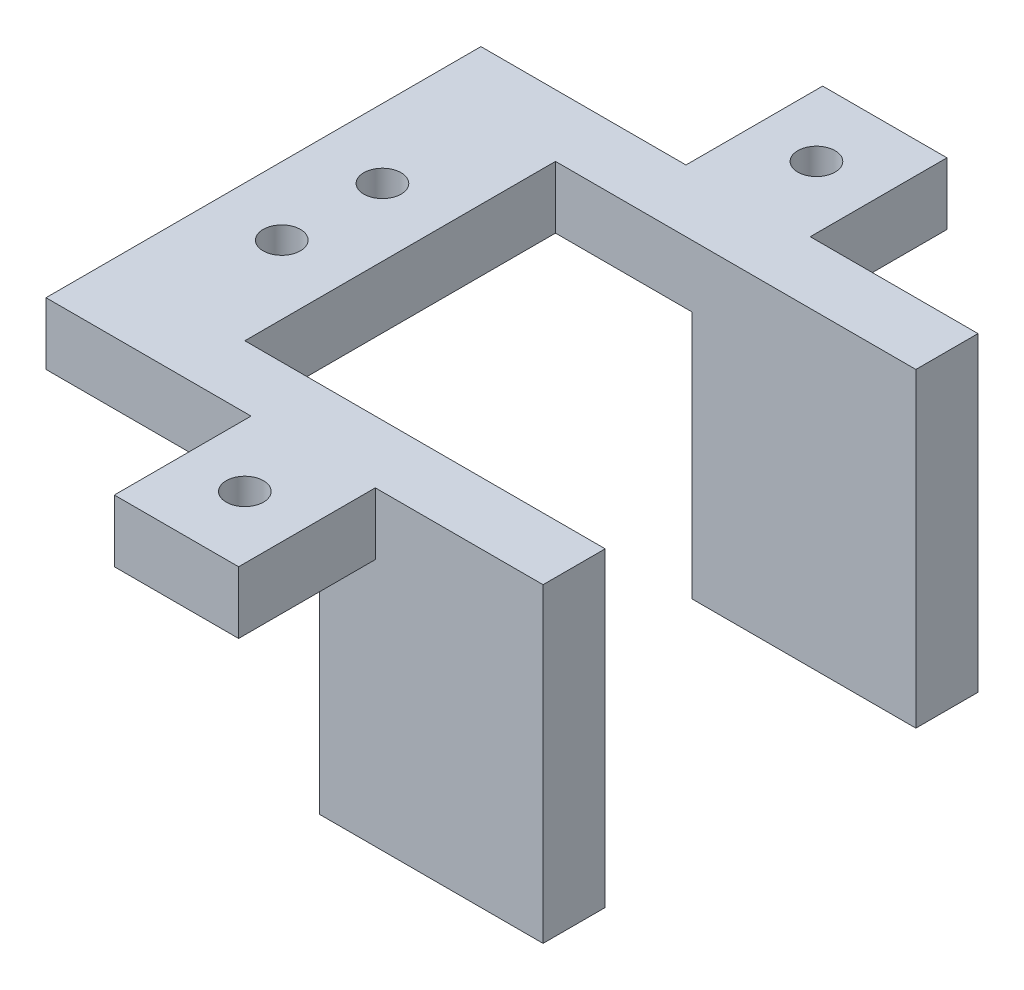
from build123d import *

# Parameters (mm, degrees)
BOSS_EXTRUDE1_DEPTH              = 5
SKETCH3_W                        = 11
SKETCH3_H                        = 5
BOSS_EXTRUDE2_DEPTH              = 5
SKETCH4_W                        = 5
SKETCH4_H                        = 5
BOSS_EXTRUDE3_DEPTH              = 21
SKETCH5_W                        = 10
SKETCH5_H                        = 5
BOSS_EXTRUDE4_DEPTH              = 20
SKETCH6_W                        = 11
SKETCH6_H                        = 5
BOSS_EXTRUDE5_DEPTH              = 5
SKETCH7_W                        = 5
SKETCH7_H                        = 5
BOSS_EXTRUDE6_DEPTH              = 21
SKETCH8_W                        = 10
SKETCH8_H                        = 5
BOSS_EXTRUDE7_DEPTH              = 20
SKETCH11_W                       = 10
SKETCH11_H                       = 5
BOSS_EXTRUDE8_DEPTH              = 3.5
SKETCH12_W                       = 10
SKETCH12_H                       = 5
BOSS_EXTRUDE9_DEPTH              = 3.5
CUT_EXTRUDE6_DEPTH               = 14.5
CUT_EXTRUDE8_DEPTH               = 41.078048855
CUT_EXTRUDE8_DEPTH_BACK          = 14.5
SKETCH17_W                       = 1.38
SKETCH17_H                       = 3.56
CUT_EXTRUDE9_DEPTH               = 14.5
CUT_EXTRUDE10_DEPTH              = 14.5
SKETCH_1_W                       = 8
SKETCH_1_H                       = 25
EXTRUDE_1_DEPTH                  = 5
SKETCH_2_W                       = 8
SKETCH_2_H                       = 25
EXTRUDE_2_DEPTH                  = 5
SKIZZE1_R                        = 1.5
SCHNITT_LINEAR_AUSTRAGEN1_DEPTH  = 10
AUFSATZ_LINEAR_AUSTRAGEN1_DEPTH  = 4
SKIZZE3_W                        = 10
SKIZZE3_H                        = 5
SCHNITT_LINEAR_AUSTRAGEN2_DEPTH  = 3.5
SCHNITT_LINEAR_AUSTRAGEN3_DEPTH  = 4
AUFSATZ_LINEAR_AUSTRAGEN3_DEPTH  = 11
SKIZZE7_R                        = 1.5
SCHNITT_LINEAR_AUSTRAGEN6_DEPTH  = 10
SKIZZE8_W                        = 10
SKIZZE8_H                        = 5
SCHNITT_LINEAR_AUSTRAGEN8_DEPTH  = 4
AUFSATZ_LINEAR_AUSTRAGEN4_DEPTH  = 4
SCHNITT_LINEAR_AUSTRAGEN9_DEPTH  = 4
AUFSATZ_LINEAR_AUSTRAGEN6_DEPTH  = 11
SKIZZE12_R                       = 1.5
SCHNITT_LINEAR_AUSTRAGEN10_DEPTH = 11


with BuildPart() as part:
    # Sketch1 → Boss-Extrude1 (new body)
    with BuildSketch(Plane(origin=(0, 0, 0), x_dir=(1, 0, 0), z_dir=(0, 1, 0))):
        Polygon((5.5, 3), (5.5, 0), (5.5, -3), (5.5, -8.5), (0, -8.5), (-5.5, -8.5), (-5.5, -3), (-5.5, 8.5), (0, 8.5), (5.5, 8.5), align=None)
    extrude(amount=BOSS_EXTRUDE1_DEPTH)

    # Sketch3 → Boss-Extrude2 (add)
    with BuildSketch(Plane.XY.offset(8.5)):
        with Locations((0, 2.5)):
            Rectangle(SKETCH3_W, SKETCH3_H)
    extrude(amount=BOSS_EXTRUDE2_DEPTH)

    # Sketch4 → Boss-Extrude3 (add)
    with BuildSketch(Plane(origin=(5.5, 0, 0), x_dir=(0, 0, -1), z_dir=(1, 0, 0))):
        with Locations((-11, 2.5)):
            Rectangle(SKETCH4_W, SKETCH4_H)
    extrude(amount=BOSS_EXTRUDE3_DEPTH)

    # Sketch5 → Boss-Extrude4 (add)
    with BuildSketch(Plane.XZ):
        with Locations((21.5, 11)):
            Rectangle(SKETCH5_W, SKETCH5_H)
    extrude(amount=BOSS_EXTRUDE4_DEPTH)

    # Sketch6 → Boss-Extrude5 (add)
    with BuildSketch(Plane(origin=(0, 0, -8.5), x_dir=(-1, 0, 0), z_dir=(0, 0, -1))):
        with Locations((0, 2.5)):
            Rectangle(SKETCH6_W, SKETCH6_H)
    extrude(amount=BOSS_EXTRUDE5_DEPTH)

    # Sketch7 → Boss-Extrude6 (add)
    with BuildSketch(Plane(origin=(5.5, 0, 0), x_dir=(0, 0, -1), z_dir=(1, 0, 0))):
        with Locations((11, 2.5)):
            Rectangle(SKETCH7_W, SKETCH7_H)
    extrude(amount=BOSS_EXTRUDE6_DEPTH)

    # Sketch8 → Boss-Extrude7 (add)
    with BuildSketch(Plane(origin=(0, 0, 0), x_dir=(-1, 0, 0), z_dir=(0, -1, 0))):
        with Locations((-21.5, 11)):
            Rectangle(SKETCH8_W, SKETCH8_H)
    extrude(amount=BOSS_EXTRUDE7_DEPTH)

    # Sketch11 → Boss-Extrude8 (add)
    with BuildSketch(Plane(origin=(0, 0, 8.5), x_dir=(-1, 0, 0), z_dir=(0, 0, -1))):
        with Locations((-21.5, -12.5)):
            Rectangle(SKETCH11_W, SKETCH11_H)
    extrude(amount=BOSS_EXTRUDE8_DEPTH)

    # Sketch12 → Boss-Extrude9 (add)
    with BuildSketch(Plane.XY.offset(-8.5)):
        with Locations((21.5, -12.5)):
            Rectangle(SKETCH12_W, SKETCH12_H)
    extrude(amount=BOSS_EXTRUDE9_DEPTH)

    # Sketch14 → Cut-Extrude6 (cut)
    with BuildSketch(Plane(origin=(26.5, 0, 0), x_dir=(0, 0, -1), z_dir=(1, 0, 0))):
        Polygon((-6.379568334, -12.879568334), (-6.379568334, -15), (-5, -15), (-5, -11.439784167), (-6.379568334, -11.439784167), align=None)
    extrude(amount=-CUT_EXTRUDE6_DEPTH, mode=Mode.SUBTRACT)

    # Sketch16 → Cut-Extrude8 (cut, two sides: drawn at the far end of the back side and taken through both)
    with BuildSketch(Plane(origin=(26.5, 0, 0), x_dir=(0, 0, -1), z_dir=(1, 0, 0)).offset(-CUT_EXTRUDE8_DEPTH_BACK)):
        Polygon((-6.379568334, -13), (-8.5, -15), (-7.439784167, -15), (-6.379568334, -15), align=None)
    extrude(amount=CUT_EXTRUDE8_DEPTH + CUT_EXTRUDE8_DEPTH_BACK, mode=Mode.SUBTRACT)

    # Sketch17 → Cut-Extrude9 (cut)
    with BuildSketch(Plane(origin=(26.5, 0, 0), x_dir=(0, 0, -1), z_dir=(1, 0, 0))):
        with Locations((5.69, -13.22)):
            Rectangle(SKETCH17_W, SKETCH17_H)
    extrude(amount=-CUT_EXTRUDE9_DEPTH, mode=Mode.SUBTRACT)

    # Sketch18 → Cut-Extrude10 (cut)
    with BuildSketch(Plane(origin=(26.5, 0, 0), x_dir=(0, 0, -1), z_dir=(1, 0, 0))):
        Polygon((6.38, -13), (6.38, -15), (8.5, -15), align=None)
    extrude(amount=-CUT_EXTRUDE10_DEPTH, mode=Mode.SUBTRACT)

    # 草图1 → 凸台-拉伸1 (add)
    with BuildSketch(Plane.XY.offset(13.5)):
        with Locations((30.5, -7.5)):
            Rectangle(SKETCH_1_W, SKETCH_1_H)
    extrude(amount=-EXTRUDE_1_DEPTH)

    # 草图2 → 凸台-拉伸2 (add)
    with BuildSketch(Plane(origin=(0, 0, -13.5), x_dir=(-1, 0, 0), z_dir=(0, 0, -1))):
        with Locations((-30.5, -7.5)):
            Rectangle(SKETCH_2_W, SKETCH_2_H)
    extrude(amount=-EXTRUDE_2_DEPTH)

    # Skizze1 → Schnitt-Linear austragen1 (cut)
    with BuildSketch(Plane(origin=(0, 5, 0), x_dir=(1, 0, 0), z_dir=(0, 1, 0))):
        with Locations(Location((-0.02687413, -4.000240759, 0), (0, 0, 270))):
            Circle(SKIZZE1_R)
        with Locations(Location((0.072523116, 4.001754227, 0), (0, 0, 270))):
            Circle(SKIZZE1_R)
    extrude(amount=-SCHNITT_LINEAR_AUSTRAGEN1_DEPTH, mode=Mode.SUBTRACT)

    # Skizze2 → Aufsatz-Linear austragen1 (add)
    with BuildSketch(Plane.XY.offset(13.5)):
        Polygon((-5.5, 5), (-5.5, 0), (16.5, 0), (16.5, -20), (34.5, -20), (34.5, 5), align=None)
    extrude(amount=AUFSATZ_LINEAR_AUSTRAGEN1_DEPTH)

    # Skizze3 → Schnitt-Linear austragen2 (cut)
    with BuildSketch(Plane(origin=(0, 0, 5), x_dir=(-1, 0, 0), z_dir=(0, 0, -1))):
        with Locations((-21.5, -12.5)):
            Rectangle(SKIZZE3_W, SKIZZE3_H)
    extrude(amount=-SCHNITT_LINEAR_AUSTRAGEN2_DEPTH, mode=Mode.SUBTRACT)

    # Skizze4 → Schnitt-Linear austragen3 (cut)
    with BuildSketch(Plane(origin=(0, 0, 8.5), x_dir=(-1, 0, 0), z_dir=(0, 0, -1))):
        Polygon((-34.5, 5), (-34.5, -20), (-16.5, -20), (-16.5, 0), (-5.5, 0), (-5.5, 5), align=None)
    extrude(amount=-SCHNITT_LINEAR_AUSTRAGEN3_DEPTH, mode=Mode.SUBTRACT)

    # Skizze6 → Aufsatz-Linear austragen3 (add)
    with BuildSketch(Plane.XY.offset(17.5)):
        Polygon((16, 5), (11, 5), (11, 0), (16.5, 0), (21, 0), (21, 5), align=None)
    extrude(amount=AUFSATZ_LINEAR_AUSTRAGEN3_DEPTH)

    # Skizze7 → Schnitt-Linear austragen6 (cut)
    with BuildSketch(Plane(origin=(0, 5, 0), x_dir=(1, 0, 0), z_dir=(0, 1, 0))):
        with Locations(Location((16, -23, 0), (0, 0, 270))):
            Circle(SKIZZE7_R)
    extrude(amount=-SCHNITT_LINEAR_AUSTRAGEN6_DEPTH, mode=Mode.SUBTRACT)

    # Skizze8 → Schnitt-Linear austragen8 (cut)
    with BuildSketch(Plane.XY.offset(-8.5)):
        with Locations((21.5, -12.5)):
            Rectangle(SKIZZE8_W, SKIZZE8_H)
    extrude(amount=SCHNITT_LINEAR_AUSTRAGEN8_DEPTH, mode=Mode.SUBTRACT)

    # Skizze9 → Aufsatz-Linear austragen4 (add)
    with BuildSketch(Plane(origin=(0, 0, -13.5), x_dir=(-1, 0, 0), z_dir=(0, 0, -1))):
        Polygon((-34.5, 5), (-34.5, -20), (-16.5, -20), (-16.5, 0), (5.5, 0), (5.5, 5), align=None)
    extrude(amount=AUFSATZ_LINEAR_AUSTRAGEN4_DEPTH)

    # Skizze10 → Schnitt-Linear austragen9 (cut)
    with BuildSketch(Plane.XY.offset(-8.5)):
        Polygon((5.5, 5), (5.5, 0), (16.5, 0), (16.5, -20), (34.5, -20), (34.5, 5), align=None)
    extrude(amount=-SCHNITT_LINEAR_AUSTRAGEN9_DEPTH, mode=Mode.SUBTRACT)

    # Skizze11 → Aufsatz-Linear austragen6 (add)
    with BuildSketch(Plane(origin=(0, 0, -17.5), x_dir=(-1, 0, 0), z_dir=(0, 0, -1))):
        Polygon((-11, 0), (-11, 5), (-21, 5), (-21, 0), (-16.5, 0), align=None)
    extrude(amount=AUFSATZ_LINEAR_AUSTRAGEN6_DEPTH)

    # Skizze12 → Schnitt-Linear austragen10 (cut)
    with BuildSketch(Plane(origin=(0, 5, 0), x_dir=(1, 0, 0), z_dir=(0, 1, 0))):
        with Locations(Location((16, 23, 0), (0, 0, 270))):
            Circle(SKIZZE12_R)
    extrude(amount=-SCHNITT_LINEAR_AUSTRAGEN10_DEPTH, mode=Mode.SUBTRACT)


solid = part.part
